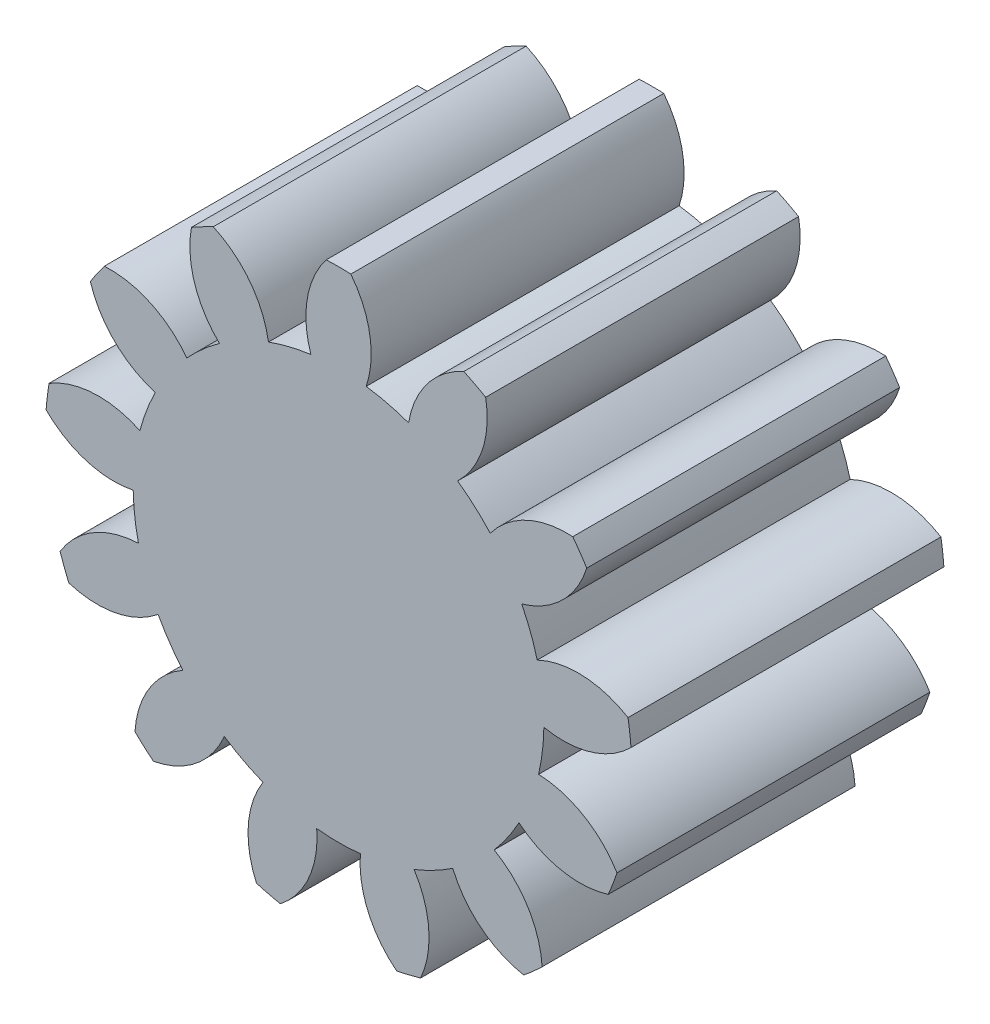
from build123d import *

# Parameters (mm, degrees)
SKETCH1_R           = 52.5
BASE_EXTRUDE_DEPTH  = 80
BOSS_EXTRUDE1_DEPTH = 80
CIRPATTERN1_COUNT   = 13


with BuildPart() as part:
    # Sketch1 → Base-Extrude (new body)
    with BuildSketch(Plane.XY):
        Circle(SKETCH1_R)
    extrude(amount=-BASE_EXTRUDE_DEPTH)

    # Sketch2 → Boss-Extrude1 (add)
    with BuildSketch(Plane.XY):
        with BuildLine():
            Line((-7.074123552, 52.021214672), (7.074123552, 52.021214672))
            ThreePointArc((7.074123552, 52.021214672), (7.998957546, 63.972407881), (3.148075167, 74.93394414))
            ThreePointArc((3.148075167, 74.93394414), (0, 75.000042411), (-3.148075167, 74.93394414))
            ThreePointArc((-3.148075167, 74.93394414), (-7.998957546, 63.972407881), (-7.074123552, 52.021214672))
        make_face()
    boss_extrude1 = extrude(amount=-BOSS_EXTRUDE1_DEPTH)

    # CirPattern1: Boss-Extrude1 ×13 about axis
    cirpattern1_axis = Axis((0, 0, 0), (0, 0, 1))
    for i in range(1, CIRPATTERN1_COUNT):
        add(boss_extrude1.rotate(cirpattern1_axis, i * 360 / CIRPATTERN1_COUNT))


solid = part.part
